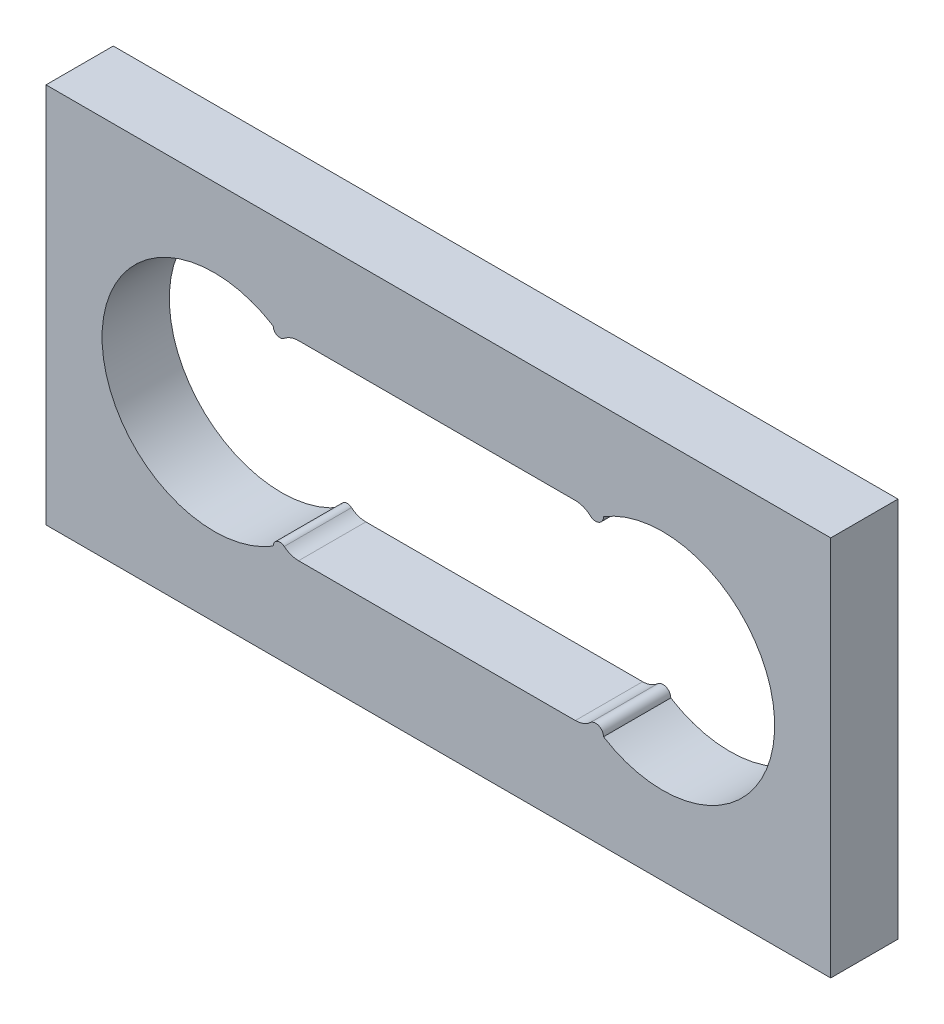
from build123d import *

# Parameters (mm, degrees)
SKETCH_1_W      = 35
SKETCH_1_H      = 17
EXTRUDE_1_DEPTH = 3
SKETCH_2_R      = 0.3
SKETCH_2_R_2    = 0.35
EXTRUDE_2_DEPTH = 3
FILLET_1_R      = 1


with BuildPart() as part:
    # 스케치1 → 보스-돌출1 (new body)
    with BuildSketch(Plane.XY):
        Rectangle(SKETCH_1_W, SKETCH_1_H)
        with BuildLine():
            Line((7.366086562, -4.25), (-7.366086562, -4.25))
            ThreePointArc((-7.366086562, -4.25), (-15, 0), (-7.366086562, 4.25))
            Line((-7.366086562, 4.25), (7.366086562, 4.25))
            ThreePointArc((7.366086562, 4.25), (12.432121791, 4.368613464), (15, 0))
            ThreePointArc((15, 0), (12.432121791, -4.368613464), (7.366086562, -4.25))
        make_face(mode=Mode.SUBTRACT)
    extrude(amount=EXTRUDE_1_DEPTH)

    # 스케치2 → 보스-돌출2 (add)
    with BuildSketch(Plane.XY.offset(3)):
        with Locations((-7.066086562, 4.25)):
            Circle(SKETCH_2_R)
        with Locations((-7.066086562, -4.25)):
            Circle(SKETCH_2_R)
        with Locations((7.016086562, -4.25)):
            Circle(SKETCH_2_R_2)
        with Locations((7.016086562, 4.25)):
            Circle(SKETCH_2_R_2)
    extrude(amount=-EXTRUDE_2_DEPTH)

    # 필렛1
    fillet_1_edges = [part.edges().sort_by_distance(p)[0] for p in [
        (-6.766086562, 4.25, 1.5),
        (-6.766086562, -4.25, 1.5),
        (6.666086562, -4.25, 1.5),
        (6.666086562, 4.25, 1.5),
    ]]
    fillet(fillet_1_edges, radius=FILLET_1_R)


solid = part.part
